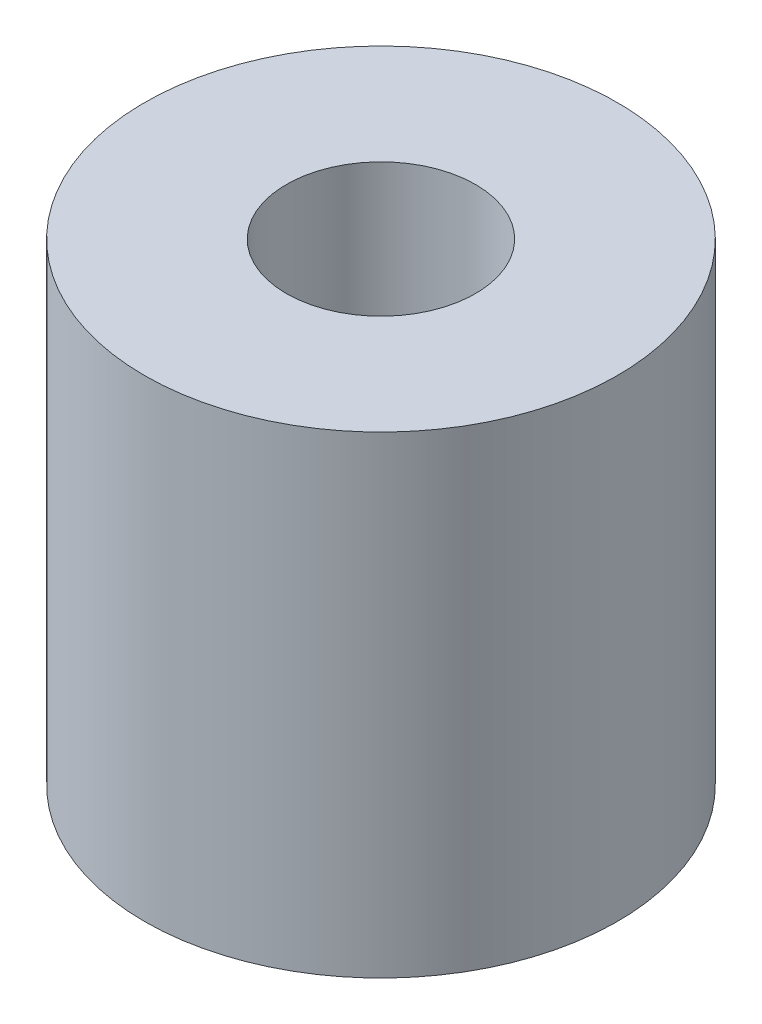
from build123d import *

# Parameters (mm, degrees)
SKETCH1_R           = 25
SKETCH1_R_2         = 10
BOSS_EXTRUDE1_DEPTH = 50


with BuildPart() as part:
    # Sketch1 → Boss-Extrude1 (new body)
    with BuildSketch(Plane(origin=(0, 0, 0), x_dir=(1, 0, 0), z_dir=(0, 1, 0))):
        with Locations(Location((0, 0, 0), (0, 0, 270))):
            Circle(SKETCH1_R)
        with Locations(Location((0, 0, 0), (0, 0, 270))):
            Circle(SKETCH1_R_2, mode=Mode.SUBTRACT)
    extrude(amount=BOSS_EXTRUDE1_DEPTH)


solid = part.part
